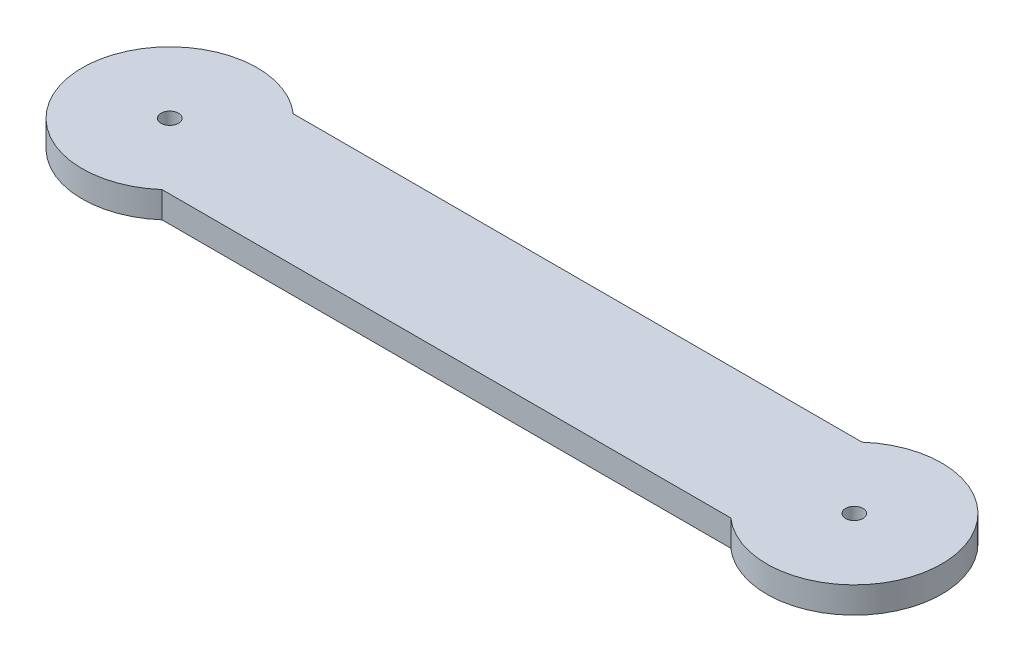
from build123d import *

# Parameters (mm, degrees)
BOSS_EXTRUDE1_DEPTH = 3
SKETCH2_R           = 1
CUT_EXTRUDE1_DEPTH  = 13


with BuildPart() as part:
    # Sketch1 → Boss-Extrude1 (new body)
    with BuildSketch(Plane(origin=(0, 0, 0), x_dir=(1, 0, 0), z_dir=(0, 1, 0))):
        with BuildLine():
            Line((0, 0), (-65, 0))
            ThreePointArc((-65, 0), (-81.614378278, 7.5), (-65, 15))
            Line((-65, 15), (0, 15))
            ThreePointArc((0, 15), (16.614378278, 7.5), (0, 0))
        make_face()
    extrude(amount=BOSS_EXTRUDE1_DEPTH)

    # Sketch2 → Cut-Extrude1 (cut)
    with BuildSketch(Plane(origin=(0, 3, 0), x_dir=(1, 0, 0), z_dir=(0, 1, 0))):
        with Locations(Location((-71.614378278, 7.5, 0), (0, 0, 270))):
            Circle(SKETCH2_R)
        with Locations(Location((6.614378278, 7.5, 0), (0, 0, 270))):
            Circle(SKETCH2_R)
    extrude(amount=-CUT_EXTRUDE1_DEPTH, mode=Mode.SUBTRACT)


solid = part.part
